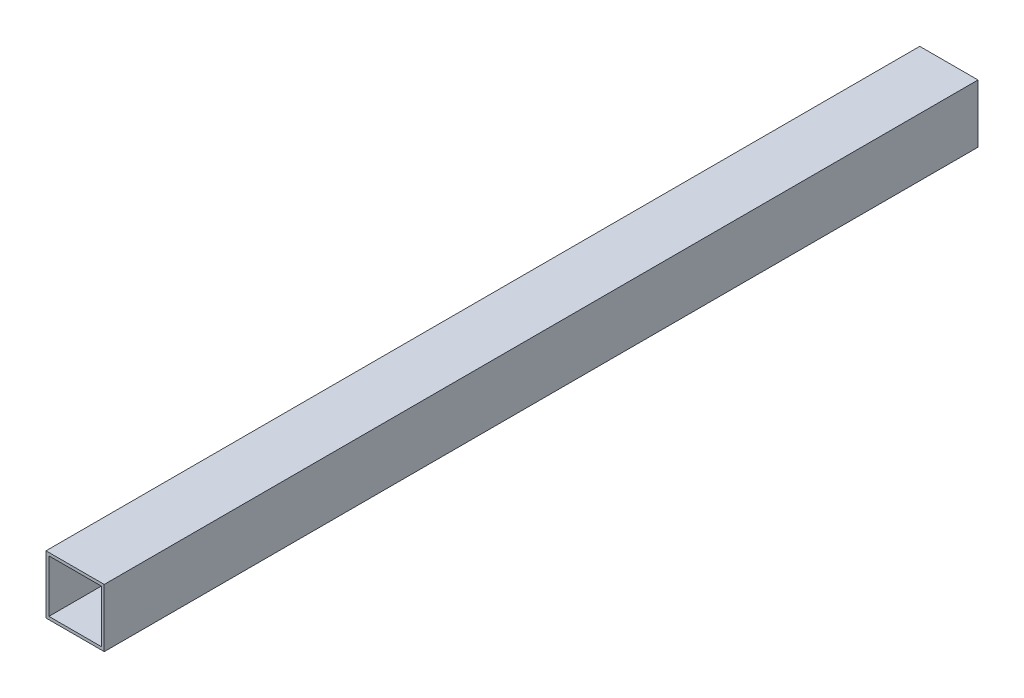
from build123d import *

# Parameters (mm, degrees)
CROQUIS1_W            = 40
CROQUIS1_H            = 40
CROQUIS1_W_2          = 36
CROQUIS1_H_2          = 36
EXTRUIR_L_MINA1_DEPTH = 600


with BuildPart() as part:
    # Croquis1 → Extruir-Lámina1 (new body)
    with BuildSketch(Plane.XY):
        Rectangle(CROQUIS1_W, CROQUIS1_H)
        Rectangle(CROQUIS1_W_2, CROQUIS1_H_2, mode=Mode.SUBTRACT)
    extrude(amount=EXTRUIR_L_MINA1_DEPTH)


solid = part.part
